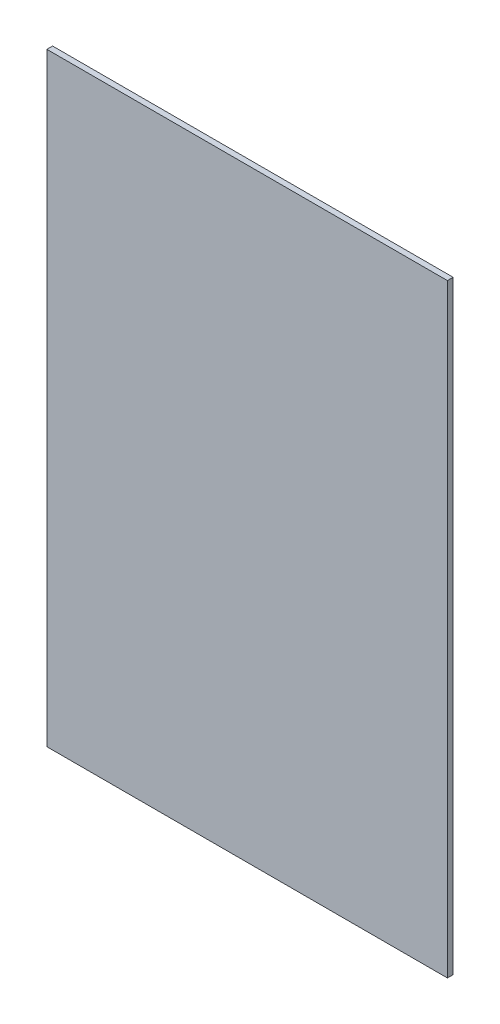
from build123d import *

# Parameters (mm, degrees)
SKETCH1_W           = 700
SKETCH1_H           = 1055.4
BOSS_EXTRUDE1_DEPTH = 10


with BuildPart() as part:
    # Sketch1 → Boss-Extrude1 (new body)
    with BuildSketch(Plane.XY):
        Rectangle(SKETCH1_W, SKETCH1_H)
    extrude(amount=BOSS_EXTRUDE1_DEPTH)


solid = part.part
